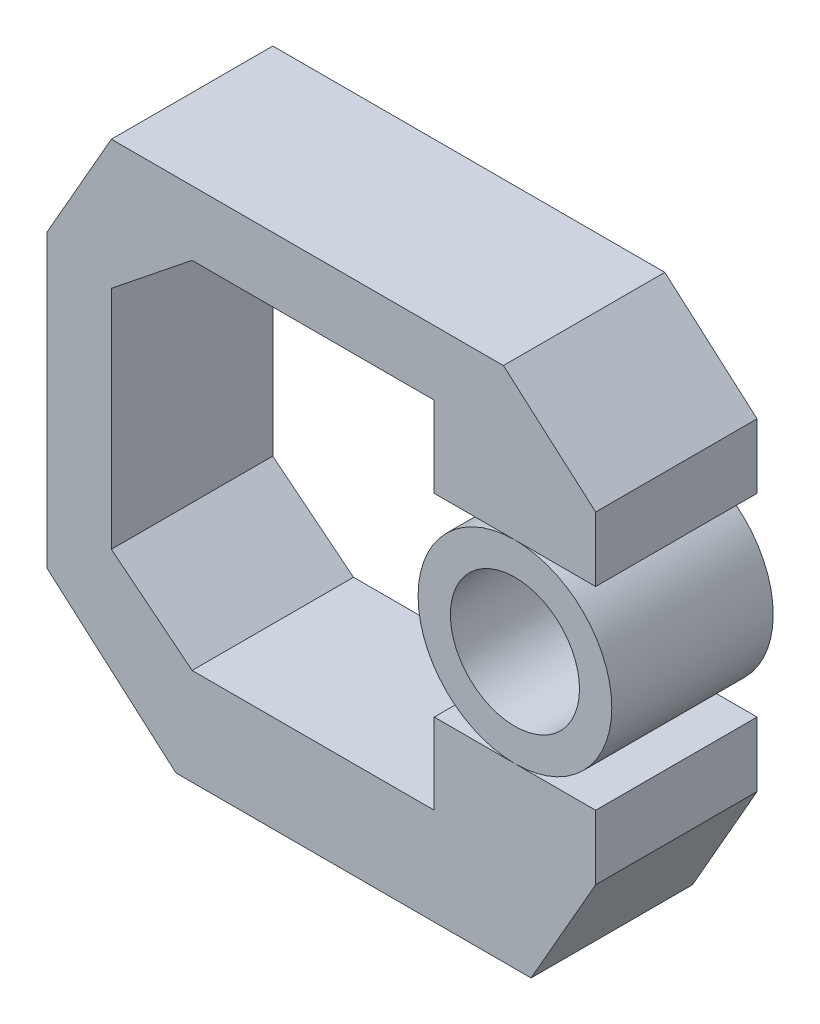
from build123d import *

# Parameters (mm, degrees)
BOSS_EXTRUDE1_DEPTH   = 5
SKETCH1_R             = 6
SKETCH1_R_2           = 4
BOSS_EXTRUDE1_2_DEPTH = 5


with BuildPart() as part:
    # Sketch1 → Boss-Extrude1 (new, symmetric)
    with BuildSketch(Plane.XY):
        Polygon((-5, 11), (-20, 11), (-25, 7), (-25, -7), (-20, -11), (-5, -11), (-5, -6), (5, -6), (5, -10), (1, -17), (-21, -17), (-29, -10), (-29, 8), (-25, 15), (-0.714285714, 15), (5, 10), (5, 6), (-5, 6), align=None)
    extrude(amount=BOSS_EXTRUDE1_DEPTH, both=True)


with BuildPart() as body_2:
    # Sketch1 → Boss-Extrude1 2 (new, symmetric)
    with BuildSketch(Plane.XY):
        Circle(SKETCH1_R)
        Circle(SKETCH1_R_2, mode=Mode.SUBTRACT)
    extrude(amount=BOSS_EXTRUDE1_2_DEPTH, both=True)


solid = Compound([part.part, body_2.part])
